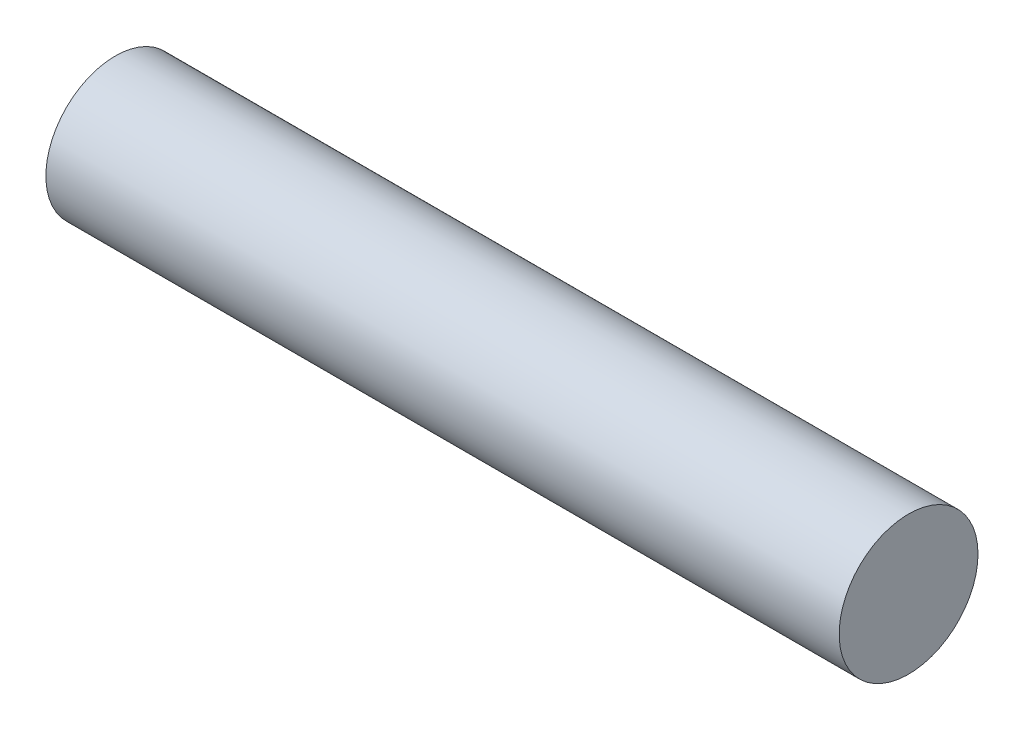
from build123d import *

# Parameters (mm, degrees)
SKETCH_1_R      = 1.75
EXTRUDE_1_DEPTH = 20


with BuildPart() as part:
    # Эскиз1 → Бобышка-Вытянуть1 (new body)
    with BuildSketch(Plane(origin=(0, 0, 0), x_dir=(0, 0, -1), z_dir=(1, 0, 0))):
        Circle(SKETCH_1_R)
    extrude(amount=EXTRUDE_1_DEPTH)


solid = part.part
